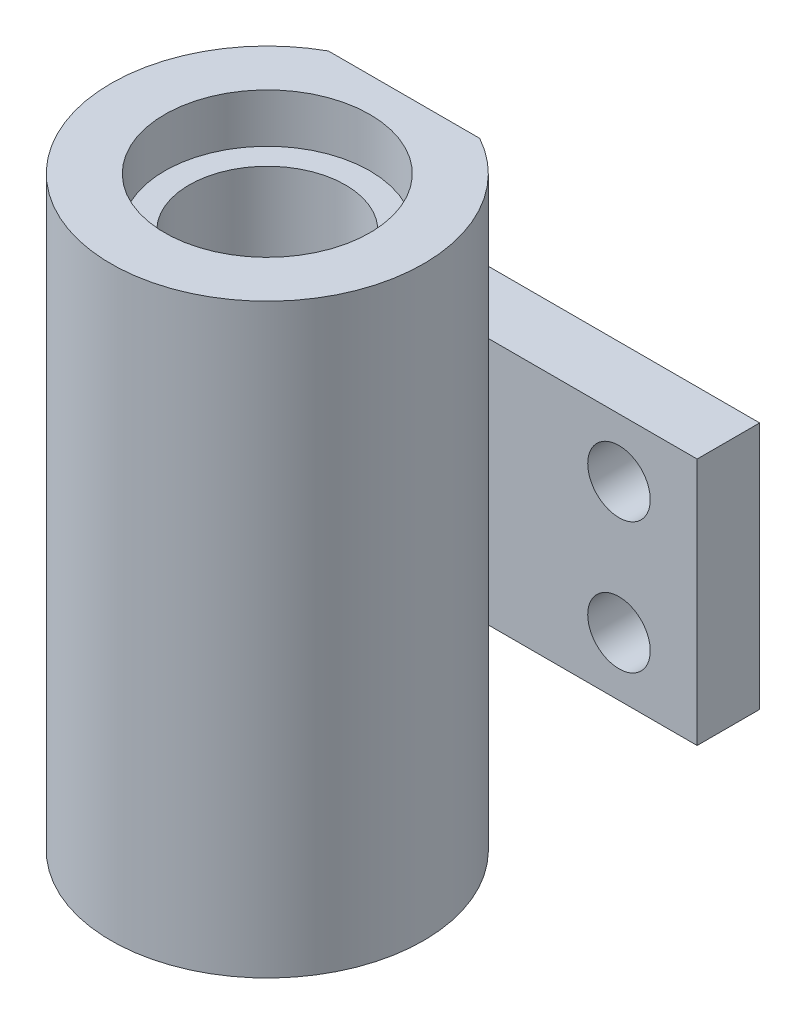
from build123d import *

# Parameters (mm, degrees)
CROQUIS2_W              = 30
CROQUIS2_H              = 10
CORTAR_EXTRUIR1_DEPTH   = 64
CROQUIS3_W              = 60
CROQUIS3_H              = 25.4
CROQUIS3_R              = 3.2
SALIENTE_EXTRUIR1_DEPTH = 6.4


with BuildPart() as part:
    # Croquis1 → Revolución1 (revolve)
    with BuildSketch(Plane.XY, mode=Mode.PRIVATE) as revoluci_n1_sk:
        Polygon((-8, 55), (-10.5, 55), (-10.5, 60), (-16, 60), (-16, 0), (-10.5, 0), (-10.5, 5), (-8, 5), align=None)
    revolve(revoluci_n1_sk.sketch.rotate(Axis((0, 0, 0), (0, 1, 0)), 270), axis=Axis((0, 0, 0), (0, 1, 0)))

    # Croquis2 → Cortar-Extruir1 (cut)
    with BuildSketch(Plane.XZ):
        with Locations((0, -19)):
            Rectangle(CROQUIS2_W, CROQUIS2_H)
    extrude(amount=-CORTAR_EXTRUIR1_DEPTH, mode=Mode.SUBTRACT)

    # Croquis3 → Saliente-Extruir1 (add)
    with BuildSketch(Plane(origin=(0, 0, -14), x_dir=(-1, 0, 0), z_dir=(0, 0, -1))):
        with Locations((0, 30)):
            Rectangle(CROQUIS3_W, CROQUIS3_H)
        with Locations((-22, 36.7)):
            Circle(CROQUIS3_R, mode=Mode.SUBTRACT)
        with Locations((-22, 23.3)):
            Circle(CROQUIS3_R, mode=Mode.SUBTRACT)
        with Locations((22, 36.7)):
            Circle(CROQUIS3_R, mode=Mode.SUBTRACT)
        with Locations((22, 23.3)):
            Circle(CROQUIS3_R, mode=Mode.SUBTRACT)
    extrude(amount=SALIENTE_EXTRUIR1_DEPTH)


solid = part.part
